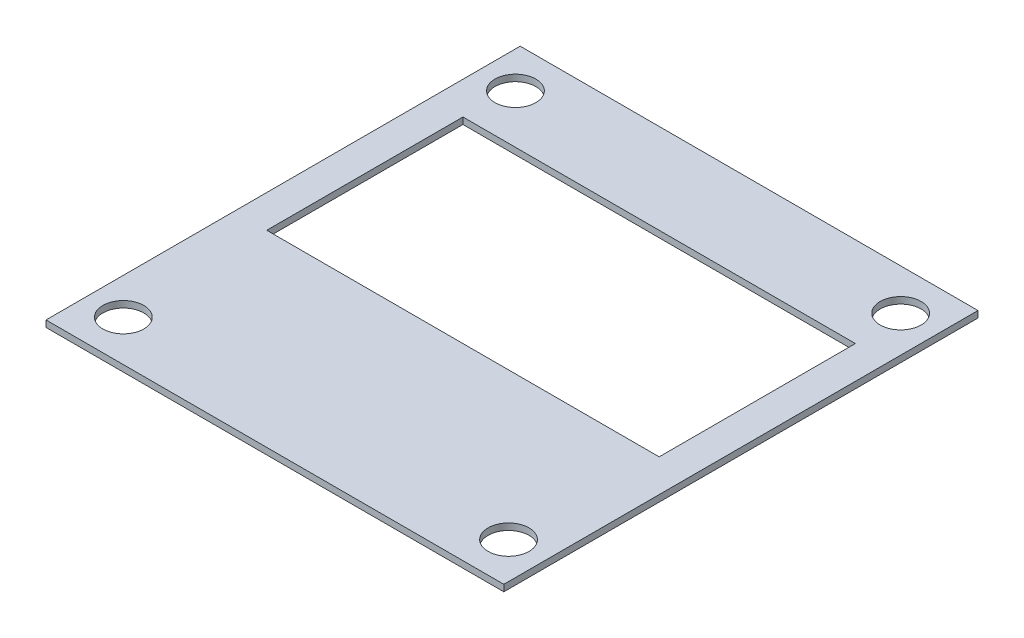
from build123d import *

# Parameters (mm, degrees)
ESQUISSE1_W             = 28
ESQUISSE1_H             = 29
ESQUISSE1_W_2           = 24
ESQUISSE1_H_2           = 12
BOSS_EXTRU_1_DEPTH      = 0.4
ESQUISSE2_R             = 1.25
ENL_V_MAT_EXTRU_1_DEPTH = 10


with BuildPart() as part:
    # Esquisse1 → Boss.-Extru.1 (new body)
    with BuildSketch(Plane(origin=(0, 0, 0), x_dir=(1, 0, 0), z_dir=(0, 1, 0))):
        Rectangle(ESQUISSE1_W, ESQUISSE1_H)
        with Locations((0, 3)):
            Rectangle(ESQUISSE1_W_2, ESQUISSE1_H_2, mode=Mode.SUBTRACT)
    extrude(amount=BOSS_EXTRU_1_DEPTH)

    # Esquisse2 → Enlèv. mat.-Extru.1 (cut)
    with BuildSketch(Plane.XZ):
        with Locations(Location((11.78, -11.99, 0), (0, 0, 270))):
            Circle(ESQUISSE2_R)
        with Locations(Location((-11.78, 11.99, 0), (0, 0, 270))):
            Circle(ESQUISSE2_R)
        with Locations(Location((11.78, 11.99, 0), (0, 0, 270))):
            Circle(ESQUISSE2_R)
        with Locations(Location((-11.78, -11.99, 0), (0, 0, 270))):
            Circle(ESQUISSE2_R)
    extrude(amount=-ENL_V_MAT_EXTRU_1_DEPTH, mode=Mode.SUBTRACT)


solid = part.part
